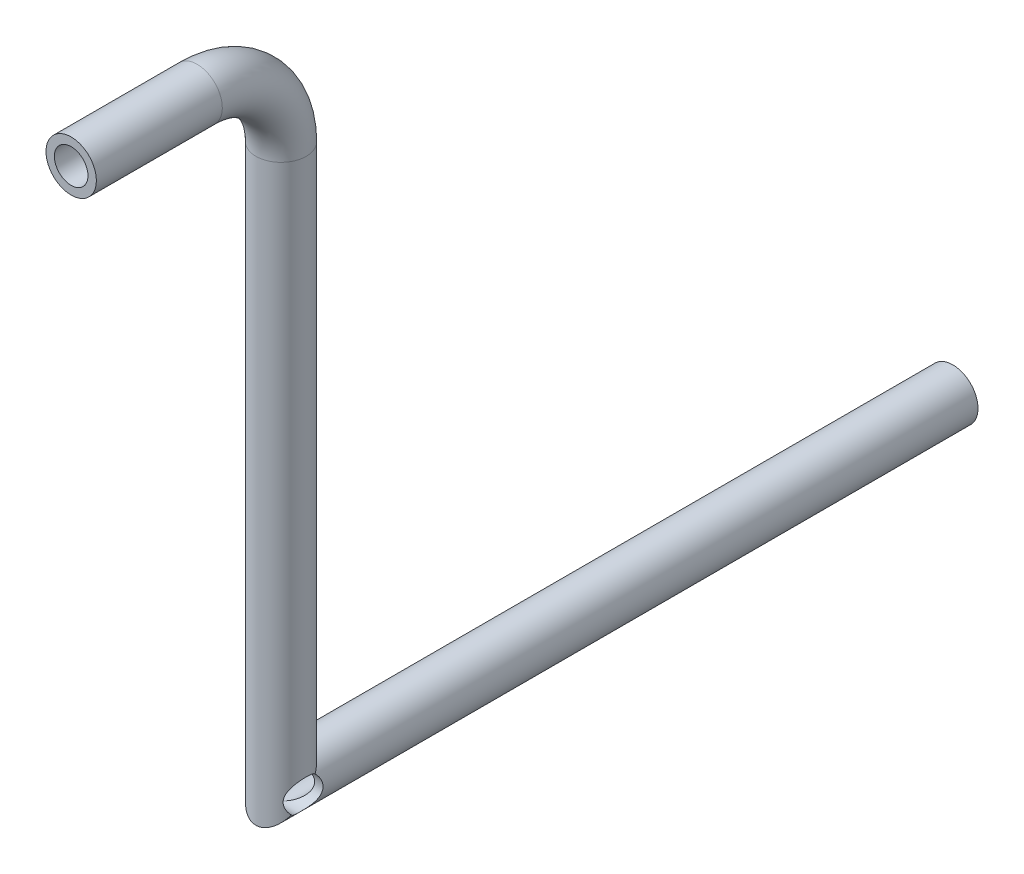
from build123d import *
from OCP.BRepAlgoAPI import BRepAlgoAPI_Cut
from OCP.TopTools import TopTools_ListOfShape

# Parameters (mm, degrees)
SWEEP_THIN1_PROFILE_R   = 30
SWEEP_THIN1_PROFILE_R_2 = 20
CUT_EXTRUDE1_DEPTH      = 1315.343942812
CUT_EXTRUDE1_DEPTH_BACK = 1315.343942812
SKETCH18_R              = 20
SKETCH19_R              = 20
CUT_EXTRUDE2_DEPTH      = 100


with BuildPart() as part:
    # Sweep-Thin1: sweep along a path in Sketch1
    with BuildLine(Plane(origin=(0, 0, 0), x_dir=(0, 0, -1), z_dir=(1, 0, 0))) as sweep_thin1_path:
        Line((0, 0), (150, 0))
        ThreePointArc((150, 0), (220.710678119, -29.289321881), (250, -100))
        Line((250, -100), (250, -760))
        Line((250, -760), (1050, -760))
    # Sweep-Thin1 profile (on start of the path) → Sweep-Thin1 (sweep)
    with BuildSketch(Plane(origin=(0, 0, 0), x_dir=(-1, 0, 0), z_dir=(0, 0, -1))):
        Circle(SWEEP_THIN1_PROFILE_R)
        Circle(SWEEP_THIN1_PROFILE_R_2, mode=Mode.SUBTRACT)
    sweep(path=sweep_thin1_path.line, transition=Transition.RIGHT)

    # Sketch18 → Cut-Extrude1 (cut, two sides: drawn at the far end of the back side and taken through both)
    with BuildSketch(Plane(origin=(0, 0, 0), x_dir=(0, 0, -1), z_dir=(1, 0, 0)).offset(-CUT_EXTRUDE1_DEPTH_BACK)):
        with Locations((250, -760)):
            Circle(SKETCH18_R)
    extrude(amount=CUT_EXTRUDE1_DEPTH + CUT_EXTRUDE1_DEPTH_BACK, mode=Mode.SUBTRACT)


with BuildPart() as cut_extrude2_tool:
    # Sketch19 → Cut-Extrude2 (new body)
    with BuildSketch(Plane.XY.offset(-350)):
        with Locations((0, -285)):
            Circle(SKETCH19_R)
    extrude(amount=CUT_EXTRUDE2_DEPTH)


with BuildPart() as part_1:
    add(part.part)

    # Cut-Extrude2: cut by cut_extrude2_tool, with a tolerance
    cut_extrude2_stock = TopTools_ListOfShape()
    cut_extrude2_stock.Append(part_1.part.wrapped)
    cut_extrude2_tools = TopTools_ListOfShape()
    cut_extrude2_tools.Append(cut_extrude2_tool.part.wrapped)
    cut_extrude2_cut = BRepAlgoAPI_Cut()
    cut_extrude2_cut.SetArguments(cut_extrude2_stock)
    cut_extrude2_cut.SetTools(cut_extrude2_tools)
    cut_extrude2_cut.SetFuzzyValue(0.00001)
    cut_extrude2_cut.Build()
    add(Compound.cast(cut_extrude2_cut.Shape()).solids(), mode=Mode.REPLACE)


solid = part_1.part
